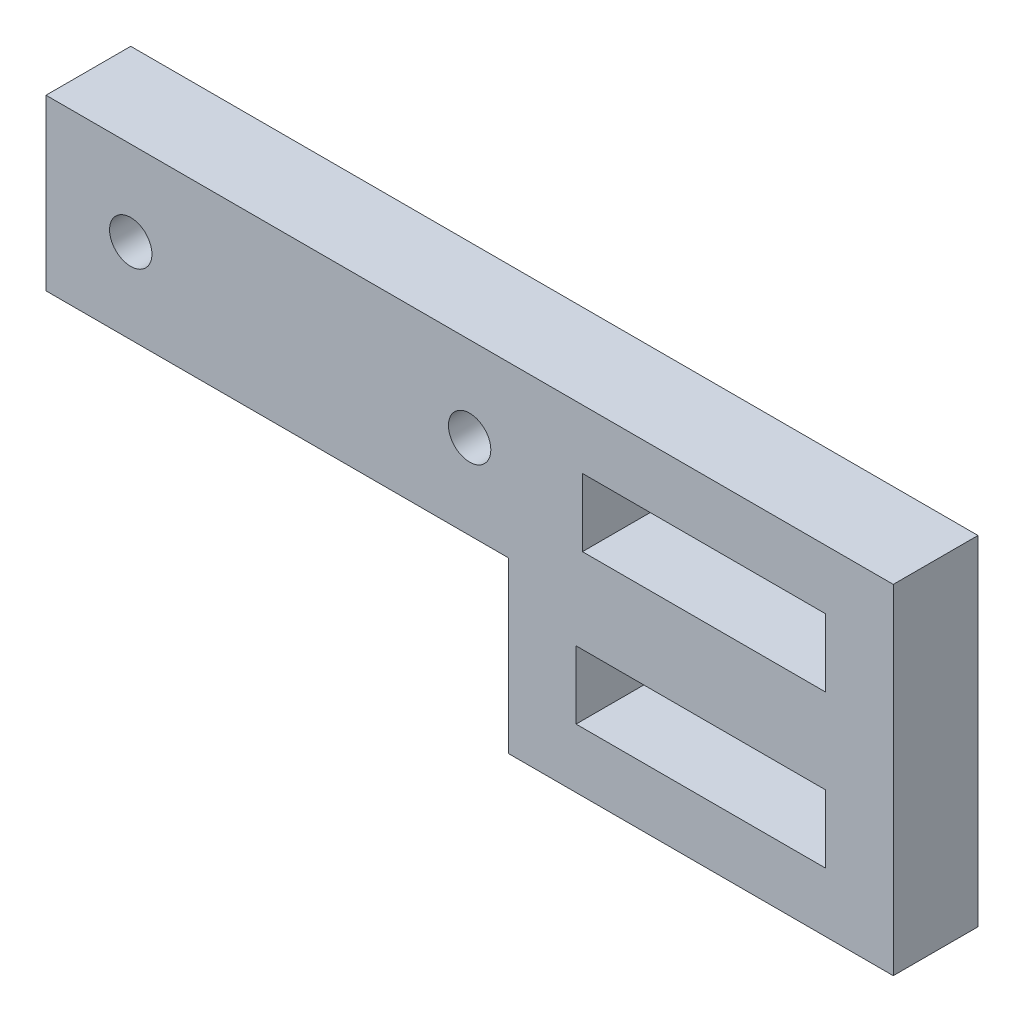
from build123d import *

# Parameters (mm, degrees)
BOSS_EXTRUDE1_DEPTH = 6.35
SKETCH2_R           = 1.5875
SKETCH2_W           = 18.214797942
SKETCH2_H           = 5.08
SKETCH2_W_2         = 18.693309481
CUT_EXTRUDE1_DEPTH  = 6.35


with BuildPart() as part:
    # Sketch1 → Boss-Extrude1 (new body)
    with BuildSketch(Plane.XY):
        Polygon((-30.283460543, 4.315489798), (33.216539457, 4.315489798), (33.216539457, -21.084510202), (4.363229976, -21.084510202), (4.363229976, -8.384510202), (-30.283460543, -8.384510202), align=None)
    extrude(amount=BOSS_EXTRUDE1_DEPTH)

    # Sketch2 → Cut-Extrude1 (cut)
    with BuildSketch(Plane.XY.offset(6.35)):
        with Locations((-23.933460543, -2.034510202)):
            Circle(SKETCH2_R)
        with Locations((1.466539457, -2.034510202)):
            Circle(SKETCH2_R)
        with Locations((19.029140486, -2.669510202)):
            Rectangle(SKETCH2_W, SKETCH2_H)
        with Locations((18.789884717, -14.099510202)):
            Rectangle(SKETCH2_W_2, SKETCH2_H)
    extrude(amount=-CUT_EXTRUDE1_DEPTH, mode=Mode.SUBTRACT)


solid = part.part
